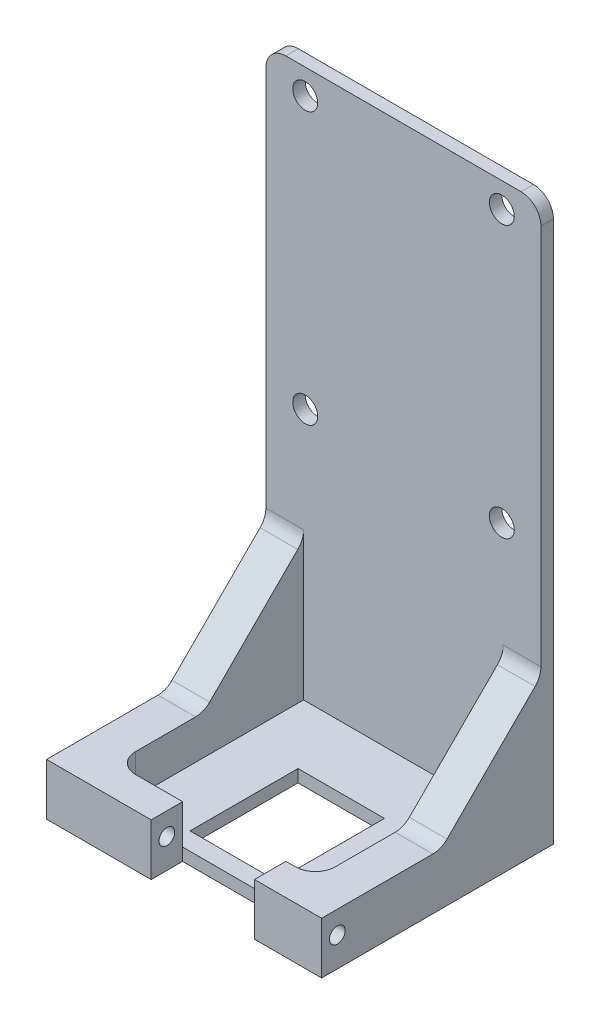
from build123d import *

# Parameters (mm, degrees)
SKETCH1_W               = 70
SKETCH1_H               = 59
BOSS_EXTRUDE1_DEPTH     = 3.175
SKETCH2_W               = 70
SKETCH2_H               = 3.175
BOSS_EXTRUDE2_DEPTH     = 139.7
SKETCH4_W               = 7.5
SKETCH4_H               = 8
BOSS_EXTRUDE3_DEPTH     = 10
SKETCH5_W               = 26.289
SKETCH5_H               = 8
CUT_EXTRUDE2_DEPTH      = 10
SKETCH3_R               = 3.175
CUT_EXTRUDE1_DEPTH      = 139.7
SKETCH9_W               = 9.593
SKETCH9_H               = 55.825
BOSS_EXTRUDE4_DEPTH     = 10
SKETCH7_W               = 22
SKETCH7_H               = 27.5
CUT_EXTRUDE6_DEPTH      = 10
CUT_EXTRUDE7_DEPTH      = 153.202212694
CUT_EXTRUDE7_DEPTH_BACK = 153.202212694
SKETCH12_R              = 2
BOSS_EXTRUDE5_DEPTH     = 9.593
BOSS_EXTRUDE6_DEPTH     = 9.593
FILLET1_R               = 5.08
FILLET2_R               = 5.08
FILLET3_R               = 5.08


with BuildPart() as part:
    # Sketch1 → Boss-Extrude1 (new body)
    with BuildSketch(Plane(origin=(0, 0, 0), x_dir=(1, 0, 0), z_dir=(0, 1, 0))):
        Rectangle(SKETCH1_W, SKETCH1_H)
    extrude(amount=BOSS_EXTRUDE1_DEPTH)

    # Sketch2 → Boss-Extrude2 (add)
    with BuildSketch(Plane(origin=(0, 3.175, 0), x_dir=(1, 0, 0), z_dir=(0, 1, 0))):
        with Locations((0, 27.9125)):
            Rectangle(SKETCH2_W, SKETCH2_H)
    extrude(amount=BOSS_EXTRUDE2_DEPTH)

    # Sketch4 → Boss-Extrude3 (add)
    with BuildSketch(Plane(origin=(0, 3.175, 0), x_dir=(1, 0, 0), z_dir=(0, 1, 0))):
        with Locations((-12.132, -25.5)):
            Rectangle(SKETCH4_W, SKETCH4_H)
        with Locations((21.657, -25.5)):
            Rectangle(SKETCH4_W, SKETCH4_H)
    extrude(amount=BOSS_EXTRUDE3_DEPTH)

    # Sketch5 → Cut-Extrude2 (cut)
    with BuildSketch(Plane(origin=(0, 3.175, 0), x_dir=(1, 0, 0), z_dir=(0, 1, 0))):
        with Locations((4.7625, -25.5)):
            Rectangle(SKETCH5_W, SKETCH5_H)
    extrude(amount=-CUT_EXTRUDE2_DEPTH, mode=Mode.SUBTRACT)

    # Sketch3 → Cut-Extrude1 (cut)
    with BuildSketch(Plane.XY.offset(-26.325)):
        with Locations((-25, 136.525)):
            Circle(SKETCH3_R)
        with Locations((25.038, 136.525)):
            Circle(SKETCH3_R)
        with Locations((25.038, 67.437)):
            Circle(SKETCH3_R)
        with Locations((-25, 67.437)):
            Circle(SKETCH3_R)
    extrude(amount=-CUT_EXTRUDE1_DEPTH, mode=Mode.SUBTRACT)

    # Sketch9 → Boss-Extrude4 (add)
    with BuildSketch(Plane(origin=(0, 3.175, 0), x_dir=(1, 0, 0), z_dir=(0, 1, 0))):
        with Locations((30.2035, -1.5875)):
            Rectangle(SKETCH9_W, SKETCH9_H)
        Polygon((-25.407, 26.325), (-35, 26.325), (-35, -29.5), (-25.407, -29.5), (-15.882, -29.5), (-15.882, -21.5), (-25.407, -21.5), align=None)
    extrude(amount=BOSS_EXTRUDE4_DEPTH)

    # Sketch7 → Cut-Extrude6 (cut)
    with BuildSketch(Plane(origin=(0, 3.175, 0), x_dir=(1, 0, 0), z_dir=(0, 1, 0))):
        with Locations((0, -3.25)):
            Rectangle(SKETCH7_W, SKETCH7_H)
    extrude(amount=-CUT_EXTRUDE6_DEPTH, mode=Mode.SUBTRACT)

    # Sketch12 → Cut-Extrude7 (cut, two sides: drawn at the far end of the back side and taken through both)
    with BuildSketch(Plane(origin=(-8.382, 0, 0), x_dir=(0, 0, -1), z_dir=(1, 0, 0)).offset(-CUT_EXTRUDE7_DEPTH_BACK)):
        with Locations((-25.5, 7.475)):
            Circle(SKETCH12_R)
    extrude(amount=CUT_EXTRUDE7_DEPTH + CUT_EXTRUDE7_DEPTH_BACK, mode=Mode.SUBTRACT)

    # Sketch13 → Boss-Extrude5 (add)
    with BuildSketch(Plane.ZY.offset(35)):
        Polygon((-26.325, 13.175), (-26.325, 38.575), (-0.925, 13.175), align=None)
    extrude(amount=-BOSS_EXTRUDE5_DEPTH)

    # Sketch14 → Boss-Extrude6 (add)
    with BuildSketch(Plane(origin=(35, 0, 0), x_dir=(0, 0, -1), z_dir=(1, 0, 0))):
        Polygon((26.325, 13.175), (26.325, 38.575), (0.925, 13.175), align=None)
    extrude(amount=-BOSS_EXTRUDE6_DEPTH)

    # Fillet1
    fillet1_edges = [part.edges().sort_by_distance(p)[0] for p in [
        (-35, 142.875, -27.9125),
        (35, 142.875, -27.9125),
    ]]
    fillet(fillet1_edges, radius=FILLET1_R)

    # Fillet2
    fillet2_edges = [part.edges().sort_by_distance(p)[0] for p in [
        (-30.2035, 13.175, -0.925),
        (-30.2035, 38.575, -26.325),
        (30.2035, 13.175, -0.925),
        (30.2035, 38.575, -26.325),
    ]]
    fillet(fillet2_edges, radius=FILLET2_R)

    # Fillet3
    fillet3_edges = [part.edges().sort_by_distance(p)[0] for p in [
        (-25.407, 8.175, 21.5),
        (25.407, 8.175, 21.5),
    ]]
    fillet(fillet3_edges, radius=FILLET3_R)


solid = part.part
